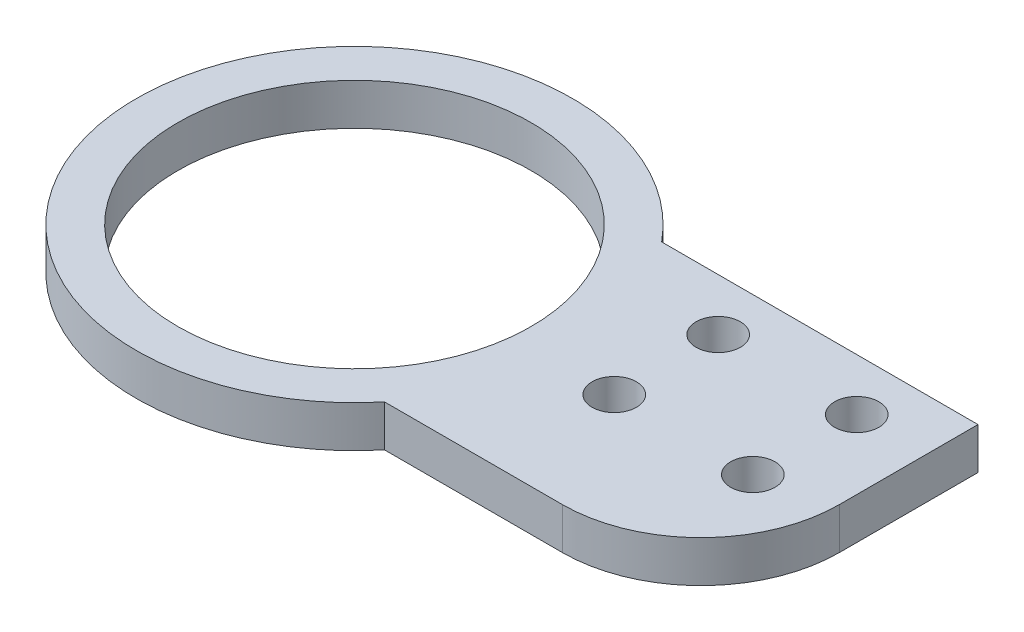
from build123d import *

# Parameters (mm, degrees)
SKETCH_1_W          = 55
SKETCH_1_H          = 20
EXTRUDE_1_DEPTH     = 3
SKETCH_2_R          = 1.6
SKETCH_2_R_2        = 6.75
CUT_EXTRUDE_1_DEPTH = 30.41513216
SKETCH_4_R          = 1.6
CUT_EXTRUDE_2_DEPTH = 30.41513216
EXTRUDE_2_DEPTH     = 3
SKETCH_6_R          = 1.6
CUT_EXTRUDE_3_DEPTH = 31.565503431
SKETCH_7_W          = 8
SKETCH_7_H          = 23
CUT_EXTRUDE_4_DEPTH = 31.565503431
SKETCH_9_R          = 18.063991313
EXTRUDE_4_DEPTH     = 3
SKETCH_10_R         = 12.75
CUT_EXTRUDE_6_DEPTH = 34.038731546
SKETCH_11_OUTSIDE_W = 67.918
SKETCH_11_OUTSIDE_H = 50.982
CUT_EXTRUDE_7_DEPTH = 34.038731546
SKETCH_12_OUTSIDE_W = 64.712
SKETCH_12_OUTSIDE_H = 45.462
CUT_EXTRUDE_8_DEPTH = 32.832569799
FILLET_1_R          = 10


with BuildPart() as part:
    # 草图1 → 凸台-拉伸1 (new body)
    with BuildSketch(Plane(origin=(0, 0, 0), x_dir=(1, 0, 0), z_dir=(0, 1, 0))):
        Rectangle(SKETCH_1_W, SKETCH_1_H)
    extrude(amount=EXTRUDE_1_DEPTH)

    # 草图2 → 切除-拉伸1 (cut, through all)
    with BuildSketch(Plane(origin=(0, 3, 0), x_dir=(1, 0, 0), z_dir=(0, 1, 0))):
        with Locations(Location((-15.727241336, 4.75, 0), (0, 0, 270))):
            Circle(SKETCH_2_R)
        with Locations((-7.5, -9.5)):
            Circle(SKETCH_2_R)
        with Locations(Location((0.727241336, 4.75, 0), (0, 0, 270))):
            Circle(SKETCH_2_R)
        with Locations(Location((-7.5, 0, 0), (0, 0, 270))):
            Circle(SKETCH_2_R_2)
    extrude(amount=-CUT_EXTRUDE_1_DEPTH, mode=Mode.SUBTRACT)

    # 草图4 → 切除-拉伸2 (cut, through all)
    with BuildSketch(Plane(origin=(0, 3, 0), x_dir=(1, 0, 0), z_dir=(0, 1, 0))):
        with Locations(Location((22.5, 6.25, 0), (0, 0, 270))):
            Circle(SKETCH_4_R)
        with Locations(Location((12.5, 6.25, 0), (0, 0, 90))):
            Circle(SKETCH_4_R)
        with Locations(Location((22.5, -1.25, 0), (0, 0, 90))):
            Circle(SKETCH_4_R)
        with Locations(Location((12.5, -1.25, 0), (0, 0, 270))):
            Circle(SKETCH_4_R)
    extrude(amount=-CUT_EXTRUDE_2_DEPTH, mode=Mode.SUBTRACT)

    # 草图5 → 凸台-拉伸2 (add)
    with BuildSketch(Plane(origin=(0, 3, 0), x_dir=(1, 0, 0), z_dir=(0, 1, 0))):
        Polygon((-27.5, -10), (-27.5, -13), (0, -13), (27.5, -13), (27.5, -10), align=None)
    extrude(amount=-EXTRUDE_2_DEPTH)

    # 草图6 → 切除-拉伸3 (cut, through all)
    with BuildSketch(Plane(origin=(0, 3, 0), x_dir=(1, 0, 0), z_dir=(0, 1, 0))):
        with Locations(Location((-7.5, -9.5, 0), (0, 0, 270))):
            Circle(SKETCH_6_R)
    extrude(amount=-CUT_EXTRUDE_3_DEPTH, mode=Mode.SUBTRACT)

    # 草图7 → 切除-拉伸4 (cut, through all)
    with BuildSketch(Plane(origin=(0, 3, 0), x_dir=(1, 0, 0), z_dir=(0, 1, 0))):
        with Locations((-23.5, -1.5)):
            Rectangle(SKETCH_7_W, SKETCH_7_H)
    extrude(amount=-CUT_EXTRUDE_4_DEPTH, mode=Mode.SUBTRACT)

    # 草图9 → 凸台-拉伸4 (add)
    with BuildSketch(Plane(origin=(0, 3, 0), x_dir=(1, 0, 0), z_dir=(0, 1, 0))):
        with Locations((-7.5, 0)):
            Circle(SKETCH_9_R)
    extrude(amount=-EXTRUDE_4_DEPTH)

    # 草图10 → 切除-拉伸6 (cut, through all)
    with BuildSketch(Plane(origin=(0, 3, 0), x_dir=(1, 0, 0), z_dir=(0, 1, 0))):
        with Locations(Location((-7.5, 0, 0), (0, 0, 270))):
            Circle(SKETCH_10_R)
    extrude(amount=-CUT_EXTRUDE_6_DEPTH, mode=Mode.SUBTRACT)

    # 草图11 outside → 切除-拉伸7 (cut, through all)
    with BuildSketch(Plane(origin=(0, 3, 0), x_dir=(1, 0, 0), z_dir=(0, 1, 0))):
        with Locations((0.968, 0)):
            Rectangle(SKETCH_11_OUTSIDE_W, SKETCH_11_OUTSIDE_H)
        with BuildLine():
            Line((27.5, 10), (4.668093524, 10))
            ThreePointArc((4.668093524, 10), (-23.092588853, 2.221187265), (1.391709622, -13))
            Line((1.391709622, -13), (27.5, -13))
            Line((27.5, -13), (27.5, 10))
        make_face(mode=Mode.SUBTRACT)
    extrude(amount=-CUT_EXTRUDE_7_DEPTH, mode=Mode.SUBTRACT)

    # 草图12 outside → 切除-拉伸8 (cut, through all)
    with BuildSketch(Plane(origin=(0, 3, 0), x_dir=(1, 0, 0), z_dir=(0, 1, 0))):
        with Locations((2.125, 0)):
            Rectangle(SKETCH_12_OUTSIDE_W, SKETCH_12_OUTSIDE_H)
        with BuildLine():
            Line((27.5, 10), (27.5, -10))
            Line((27.5, -10), (4.668093524, -10))
            ThreePointArc((4.668093524, -10), (-23.25, 0), (4.668093524, 10))
            Line((4.668093524, 10), (27.5, 10))
        make_face(mode=Mode.SUBTRACT)
    extrude(amount=-CUT_EXTRUDE_8_DEPTH, mode=Mode.SUBTRACT)

    # 圆角1
    fillet_1_edges = [part.edges().sort_by_distance(p)[0] for p in [
        (27.5, 1.5, 10),
    ]]
    fillet(fillet_1_edges, radius=FILLET_1_R)


solid = part.part
